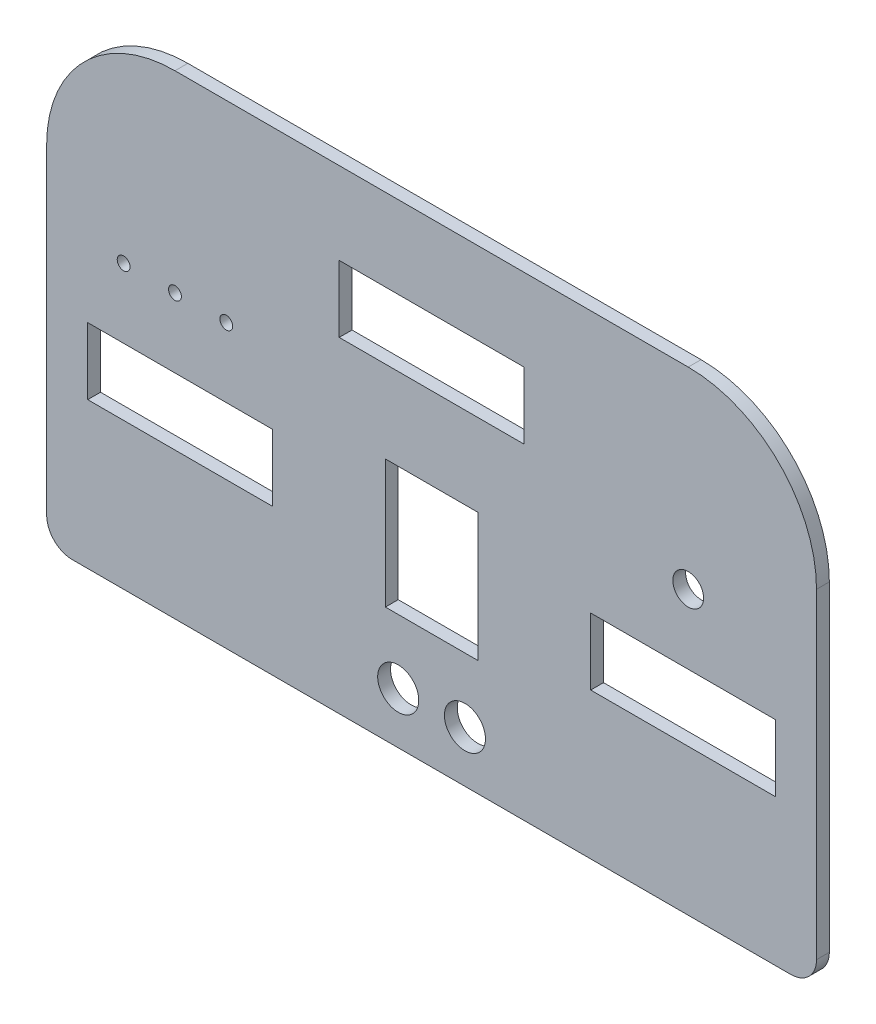
from build123d import *

# Parameters (mm, degrees)
SKETCH1_R           = 8
SKETCH1_R_2         = 6
SKETCH1_R_3         = 2.5
SKETCH1_W           = 72
SKETCH1_H           = 26
SKETCH1_W_2         = 36
SKETCH1_H_2         = 50
BOSS_EXTRUDE1_DEPTH = 5


with BuildPart() as part:
    # Sketch1 → Boss-Extrude1 (new body)
    with BuildSketch(Plane.XY):
        with BuildLine():
            Line((140, -92.5), (-140, -92.5))
            ThreePointArc((-140, -92.5), (-147.071067812, -89.571067812), (-150, -82.5))
            Line((-150, -82.5), (-150, 42.5))
            ThreePointArc((-150, 42.5), (-135.355339059, 77.855339059), (-100, 92.5))
            Line((-100, 92.5), (100, 92.5))
            ThreePointArc((100, 92.5), (135.355339059, 77.855339059), (150, 42.5))
            Line((150, 42.5), (150, -82.5))
            ThreePointArc((150, -82.5), (147.071067812, -89.571067812), (140, -92.5))
        make_face()
        with Locations((-13, -72.5)):
            Circle(SKETCH1_R, mode=Mode.SUBTRACT)
        with Locations(Location((13, -72.5, 0), (0, 0, 180))):
            Circle(SKETCH1_R, mode=Mode.SUBTRACT)
        with Locations((100, 17.5)):
            Circle(SKETCH1_R_2, mode=Mode.SUBTRACT)
        with Locations((-120, 17.5)):
            Circle(SKETCH1_R_3, mode=Mode.SUBTRACT)
        with Locations((-100, 17.5)):
            Circle(SKETCH1_R_3, mode=Mode.SUBTRACT)
        with Locations((-80, 17.5)):
            Circle(SKETCH1_R_3, mode=Mode.SUBTRACT)
        with Locations((-98, -22.5)):
            Rectangle(SKETCH1_W, SKETCH1_H, mode=Mode.SUBTRACT)
        with Locations((0, 47.5)):
            Rectangle(SKETCH1_W, SKETCH1_H, mode=Mode.SUBTRACT)
        with Locations((98, -22.5)):
            Rectangle(SKETCH1_W, SKETCH1_H, mode=Mode.SUBTRACT)
        with Locations((0, -22.5)):
            Rectangle(SKETCH1_W_2, SKETCH1_H_2, mode=Mode.SUBTRACT)
    extrude(amount=BOSS_EXTRUDE1_DEPTH)


solid = part.part
